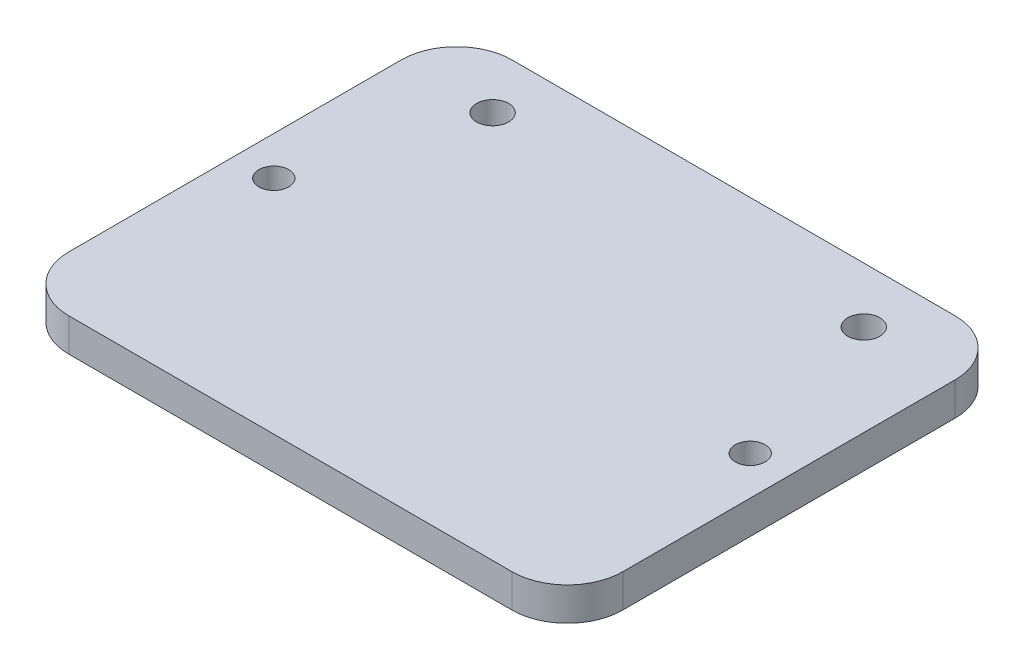
from build123d import *

# Parameters (mm, degrees)
SKETCH1_W                  = 50
SKETCH1_H                  = 40
BOSS_EXTRUDE1_DEPTH        = 3
M2_5_CLEARANCE_HOLE1_D     = 2.9
M2_5_CLEARANCE_HOLE1_DEPTH = 15.24
M2_5_CLEARANCE_HOLE1_TIP   = 0.871247898
M2_5_CLEARANCE_HOLE2_D     = 2.7
M2_5_CLEARANCE_HOLE2_DEPTH = 15.24
M2_5_CLEARANCE_HOLE2_TIP   = 0.811161836
FILLET1_R                  = 5


with BuildPart() as part:
    # Sketch1 → Boss-Extrude1 (new body)
    with BuildSketch(Plane(origin=(0, 0, 0), x_dir=(1, 0, 0), z_dir=(0, 1, 0))):
        with Locations((25, 20)):
            Rectangle(SKETCH1_W, SKETCH1_H)
    extrude(amount=BOSS_EXTRUDE1_DEPTH)

    # M2.5 Clearance Hole1
    with Locations(Plane(origin=(0, 3, 0), x_dir=(1, 0, 0), z_dir=(0, 1, 0))):
        with Locations((8.25, 35), (41.75, 35)):
            Hole(M2_5_CLEARANCE_HOLE1_D / 2, depth=M2_5_CLEARANCE_HOLE1_DEPTH)
            with Locations((0, 0, -(M2_5_CLEARANCE_HOLE1_DEPTH + M2_5_CLEARANCE_HOLE1_TIP / 2))):  # 118° drill point
                Cone(0, M2_5_CLEARANCE_HOLE1_D / 2, M2_5_CLEARANCE_HOLE1_TIP, mode=Mode.SUBTRACT)

    # M2.5 Clearance Hole2
    with Locations(Plane(origin=(0, 3, 0), x_dir=(1, 0, 0), z_dir=(0, 1, 0))):
        with Locations((3.5, 20), (46.5, 20)):
            Hole(M2_5_CLEARANCE_HOLE2_D / 2, depth=M2_5_CLEARANCE_HOLE2_DEPTH)
            with Locations((0, 0, -(M2_5_CLEARANCE_HOLE2_DEPTH + M2_5_CLEARANCE_HOLE2_TIP / 2))):  # 118° drill point
                Cone(0, M2_5_CLEARANCE_HOLE2_D / 2, M2_5_CLEARANCE_HOLE2_TIP, mode=Mode.SUBTRACT)

    # Fillet1
    fillet1_edges = [part.edges().sort_by_distance(p)[0] for p in [
        (0, 1.5, -40),
        (50, 1.5, -40),
        (50, 1.5, 0),
        (0, 1.5, 0),
    ]]
    fillet(fillet1_edges, radius=FILLET1_R)


solid = part.part
